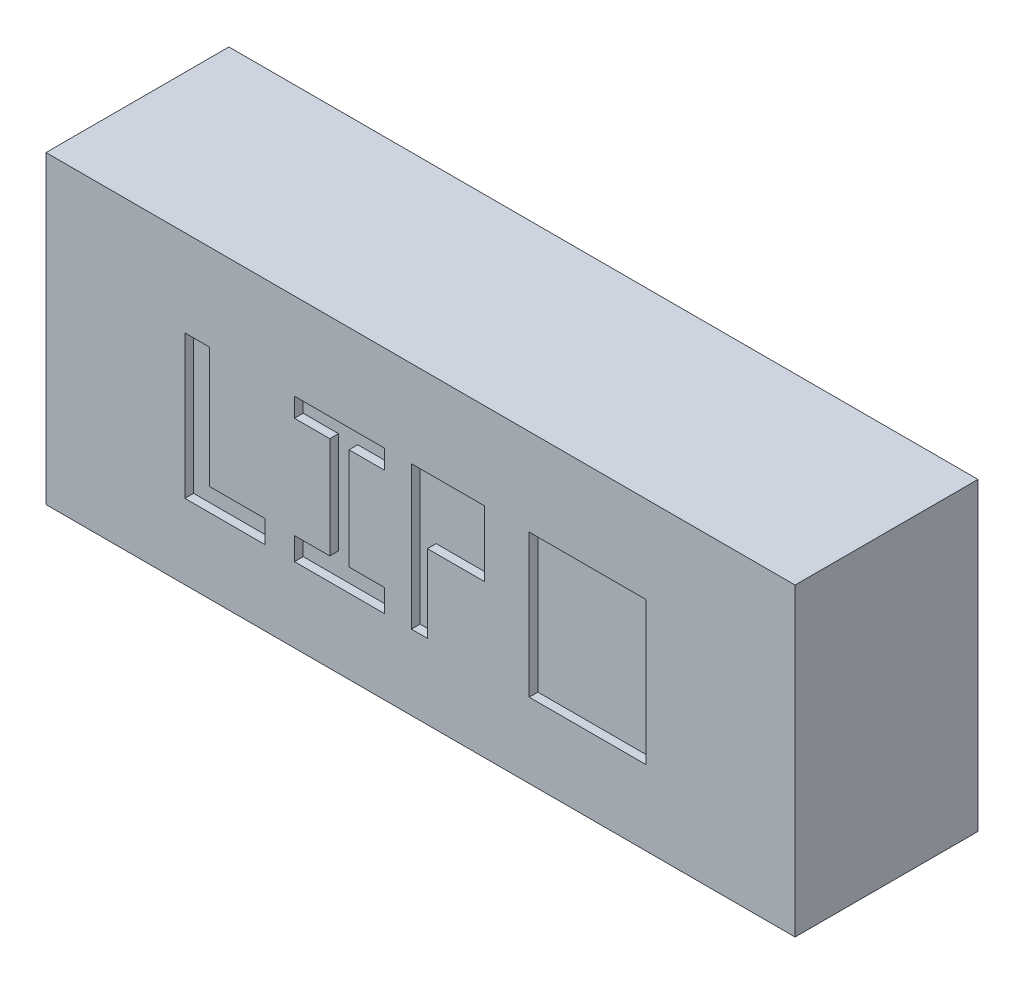
from build123d import *

# Parameters (mm, degrees)
SKETCH1_W           = 86
SKETCH1_H           = 21
BOSS_EXTRUDE1_DEPTH = 35
SKETCH2_W           = 13.394867866
SKETCH2_H           = 16.41192305
CUT_EXTRUDE1_DEPTH  = 1


with BuildPart() as part:
    # Sketch1 → Boss-Extrude1 (new body)
    with BuildSketch(Plane(origin=(0, 0, 0), x_dir=(1, 0, 0), z_dir=(0, 1, 0))):
        Rectangle(SKETCH1_W, SKETCH1_H)
    extrude(amount=BOSS_EXTRUDE1_DEPTH)

    # Sketch2 → Cut-Extrude1 (cut)
    with BuildSketch(Plane.XY.offset(10.5)):
        Polygon((-27.062922658, 25.043511527), (-27.062922658, 8.589083039), (-17.841816761, 8.589083039), (-17.841816761, 11.184244579), (-24.246896306, 11.184244579), (-24.246896306, 25.043511527), align=None)
        Polygon((-14.472064369, 25.043511527), (-4.155267693, 25.043511527), (-4.155267693, 22.842768469), (-8.207777961, 22.842768469), (-8.207777961, 11.184244579), (-4.155267693, 11.184244579), (-4.155267693, 8.589083039), (-14.472064369, 8.589083039), (-14.472064369, 11.184244579), (-10.419554101, 11.184244579), (-10.419554101, 22.842768469), (-14.472064369, 22.842768469), align=None)
        Polygon((-1.057635761, 25.043511527), (-1.057635761, 8.589083039), (0.791487413, 8.589083039), (0.791487413, 17.514312266), (7.331069367, 17.514312266), (7.331069367, 25.043511527), align=None)
        with Locations((19.169967733, 16.795044564)):
            Rectangle(SKETCH2_W, SKETCH2_H)
    extrude(amount=-CUT_EXTRUDE1_DEPTH, mode=Mode.SUBTRACT)


solid = part.part
